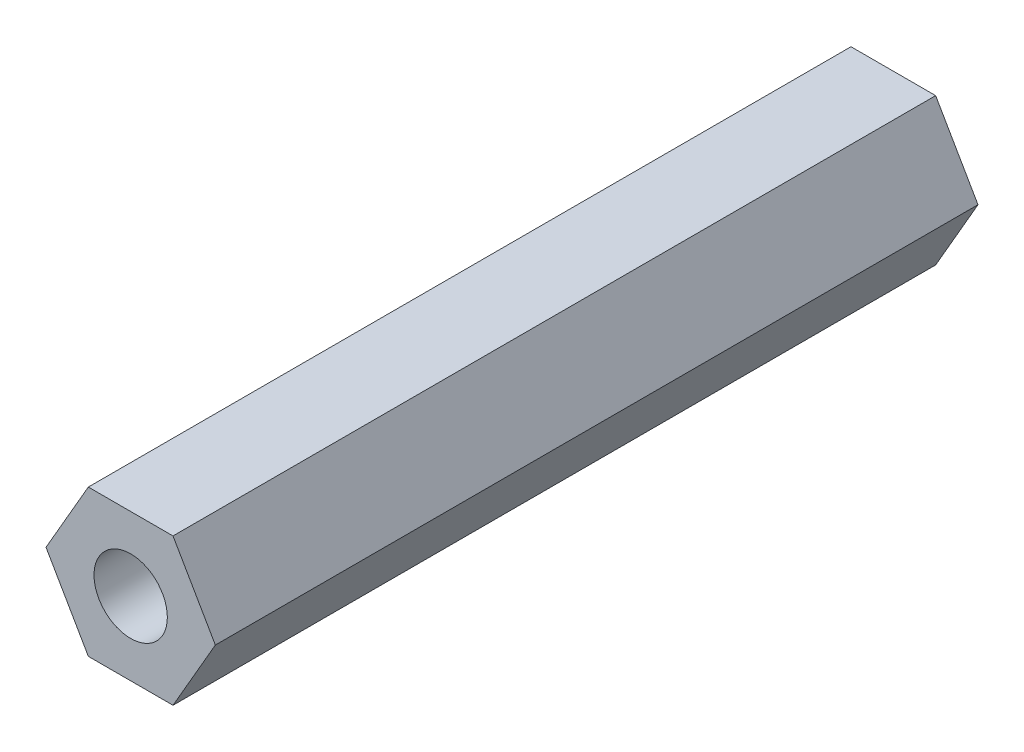
from build123d import *

# Parameters (mm, degrees)
SKETCH_1_R             = 1.5
EXTRUDE_1_DEPTH        = 26
HOLE_WIZARD_M3_1_D     = 2.5
HOLE_WIZARD_M3_1_DEPTH = 7.5
HOLE_WIZARD_M3_1_TIP   = 0.751075774


with BuildPart() as part:
    # 草图1 → 凸台-拉伸1 (new body)
    # profile 1 of 2: a face of its own
    with BuildSketch(Plane.XY):
        Polygon((-1.443375673, -2.5), (1.443375673, -2.5), (2.886751346, 0), (1.443375673, 2.5), (-1.443375673, 2.5), (-2.886751346, 0), align=None)
        Circle(SKETCH_1_R, mode=Mode.SUBTRACT)
    # profile 2 of 2: a face of its own
    with BuildSketch(Plane.XY):
        Circle(SKETCH_1_R)
    extrude(amount=EXTRUDE_1_DEPTH)

    # M3 螺纹孔1
    with Locations(Plane.XY.offset(26)):
        with Locations((0, 0)):
            Hole(HOLE_WIZARD_M3_1_D / 2, depth=HOLE_WIZARD_M3_1_DEPTH)
            with Locations((0, 0, -(HOLE_WIZARD_M3_1_DEPTH + HOLE_WIZARD_M3_1_TIP / 2))):  # 118° drill point
                Cone(0, HOLE_WIZARD_M3_1_D / 2, HOLE_WIZARD_M3_1_TIP, mode=Mode.SUBTRACT)


solid = part.part
